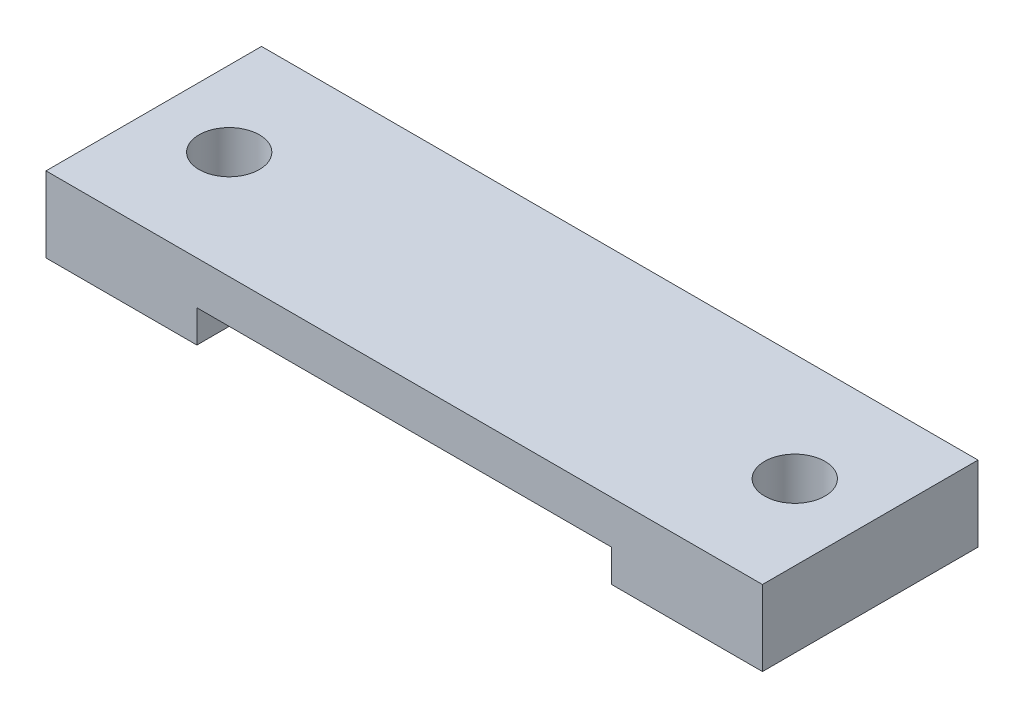
from build123d import *

# Parameters (mm, degrees)
SKETCH1_W             = 7
SKETCH1_H             = 10
SKETCH1_R             = 1.4
BOSS_EXTRUDE1_DEPTH   = 3.5
BOSS_EXTRUDE1_2_DEPTH = 3.5
SKETCH1_3_W           = 19.24
SKETCH1_3_H           = 10
BOSS_EXTRUDE2_DEPTH   = 2


with BuildPart() as part:
    # Sketch1 → Boss-Extrude1 (new body)
    with BuildSketch(Plane(origin=(0, 0, 0), x_dir=(1, 0, 0), z_dir=(0, 1, 0))):
        with Locations((-13.12, 0)):
            Rectangle(SKETCH1_W, SKETCH1_H)
        with Locations((-13.12, 0)):
            Circle(SKETCH1_R, mode=Mode.SUBTRACT)
    extrude(amount=-BOSS_EXTRUDE1_DEPTH)



with BuildPart() as body_2:
    # Sketch1 → Boss-Extrude1 2 (new body)
    with BuildSketch(Plane(origin=(0, 0, 0), x_dir=(1, 0, 0), z_dir=(0, 1, 0))):
        with Locations((13.12, 0)):
            Rectangle(SKETCH1_W, SKETCH1_H)
        with Locations((13.12, 0)):
            Circle(SKETCH1_R, mode=Mode.SUBTRACT)
    extrude(amount=-BOSS_EXTRUDE1_2_DEPTH)


with BuildPart() as part_1:
    add(part.part)

    add(body_2.part)  # Boss-Extrude2 merges body 2
    # Sketch1<3> → Boss-Extrude2 (add)
    with BuildSketch(Plane(origin=(0, 0, 0), x_dir=(1, 0, 0), z_dir=(0, 1, 0))):
        Rectangle(SKETCH1_3_W, SKETCH1_3_H)
    extrude(amount=-BOSS_EXTRUDE2_DEPTH)


solid = part_1.part
